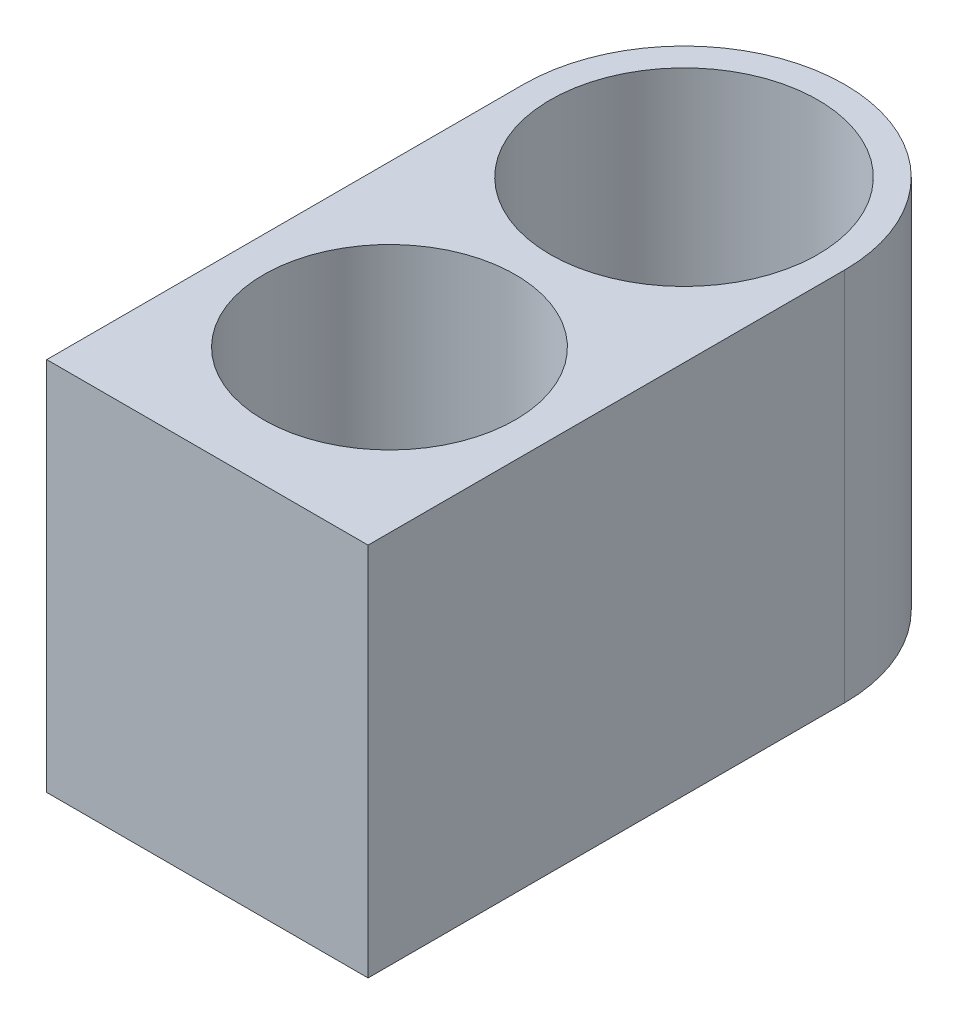
from build123d import *

# Parameters (mm, degrees)
SKETCH4_W           = 6
SKETCH4_H           = 12
BOSS_EXTRUDE2_DEPTH = 7
SKETCH5_R           = 2.35
SKETCH5_R_2         = 2.5
CUT_EXTRUDE2_DEPTH  = 10.695359715
CUT_EXTRUDE3_DEPTH  = 10.695359715


with BuildPart() as part:
    # Sketch4 → Boss-Extrude2 (new body)
    with BuildSketch(Plane(origin=(0, 0, 0), x_dir=(1, 0, 0), z_dir=(0, 1, 0))):
        Rectangle(SKETCH4_W, SKETCH4_H)
    extrude(amount=BOSS_EXTRUDE2_DEPTH)

    # Sketch5 → Cut-Extrude2 (cut, through all)
    with BuildSketch(Plane(origin=(0, 7, 0), x_dir=(1, 0, 0), z_dir=(0, 1, 0))):
        with Locations(Location((0, -2.6, 0), (0, 0, 270))):
            Circle(SKETCH5_R)
        with Locations(Location((0, 2.9, 0), (0, 0, 270))):
            Circle(SKETCH5_R_2)
    extrude(amount=-CUT_EXTRUDE2_DEPTH, mode=Mode.SUBTRACT)

    # Sketch7 → Cut-Extrude3 (cut, through all)
    with BuildSketch(Plane(origin=(0, 7, 0), x_dir=(1, 0, 0), z_dir=(0, 1, 0))):
        with BuildLine():
            Line((-3, 2.9), (-3, 6))
            Line((-3, 6), (3, 6))
            Line((3, 6), (3, 2.9))
            ThreePointArc((3, 2.9), (0, 5.9), (-3, 2.9))
        make_face()
    extrude(amount=-CUT_EXTRUDE3_DEPTH, mode=Mode.SUBTRACT)


solid = part.part
